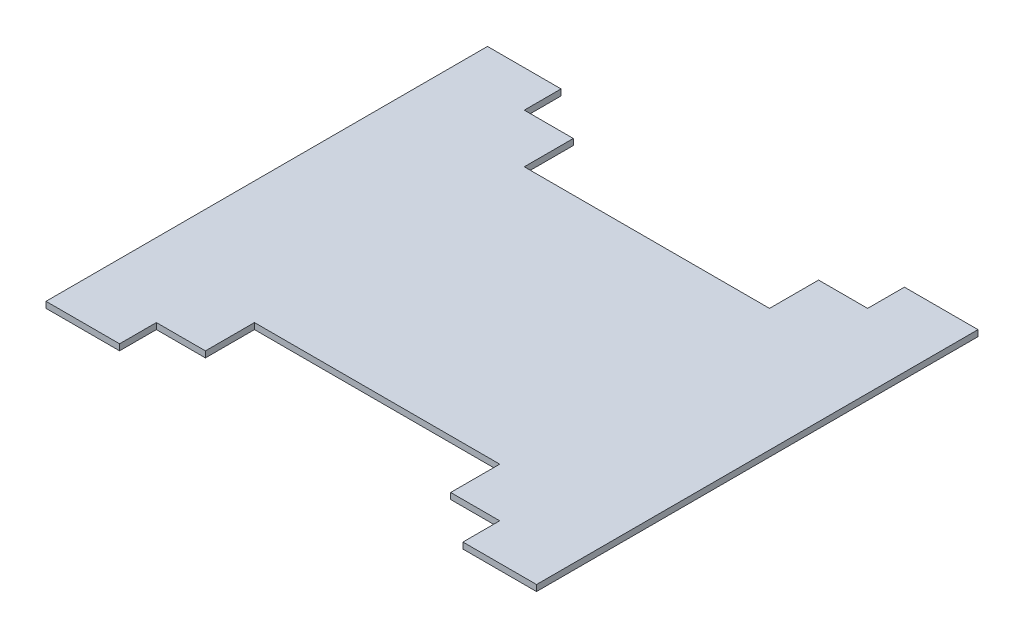
from build123d import *

# Parameters (mm, degrees)
EXTRUDE_1_DEPTH = 5


with BuildPart() as part:
    # 草圖4 → 伸長1 (new body)
    with BuildSketch(Plane(origin=(0, 0, 0), x_dir=(1, 0, 0), z_dir=(0, 1, 0))):
        Polygon((-200, 180), (-140, 180), (-140, 150), (-100, 150), (-100, 110), (100, 110), (100, 150), (140, 150), (140, 180), (200, 180), (200, -180), (140, -180), (140, -150), (100, -150), (100, -110), (-100, -110), (-100, -150), (-140, -150), (-140, -180), (-200, -180), align=None)
    extrude(amount=EXTRUDE_1_DEPTH)


solid = part.part
